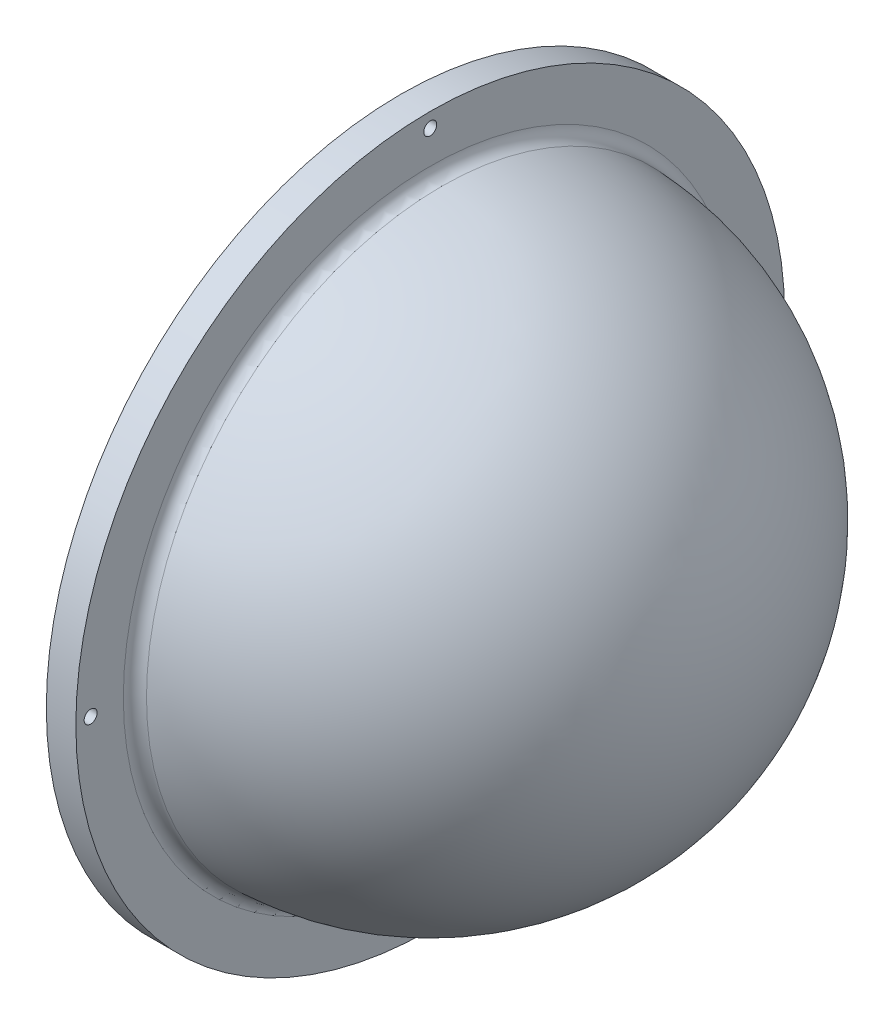
from build123d import *

# Parameters (mm, degrees)
FILLET1_R          = 2.54
SKETCH2_R          = 1.395150395
CUT_EXTRUDE1_DEPTH = 126.080494205


with BuildPart() as part:
    # Sketch1 → Revolve1 (revolve)
    with BuildSketch(Plane.XY, mode=Mode.PRIVATE) as revolve1_sk:
        with BuildLine():
            Line((0, 76.2), (6.35, 76.2))
            Line((6.35, 76.2), (6.35, 63.5))
            ThreePointArc((6.35, 63.5), (51.251280605, 44.901280605), (69.85, 0))
            Line((69.85, 0), (63.5, 0))
            ThreePointArc((63.5, 0), (46.761152545, 40.411152545), (6.35, 57.15))
            Line((6.35, 57.15), (0, 57.15))
            Line((0, 57.15), (0, 76.2))
        make_face()
    revolve(revolve1_sk.sketch.rotate(Axis((0, 0, 0), (1, 0, 0)), 90), axis=Axis((0, 0, 0), (1, 0, 0)))

    # Fillet1
    fillet1_edges = [part.edges().sort_by_distance(p)[0] for p in [
        (6.35, 0, -63.5),
    ]]
    fillet(fillet1_edges, radius=FILLET1_R)

    # Sketch2 → Cut-Extrude1 (cut, through all)
    with BuildSketch(Plane(origin=(6.35, 0, 0), x_dir=(0, 0, -1), z_dir=(1, 0, 0))):
        with Locations((0, 73.025)):
            Circle(SKETCH2_R)
        with Locations((73.025, 0)):
            Circle(SKETCH2_R)
        with Locations((0, -73.025)):
            Circle(SKETCH2_R)
        with Locations((-73.025, 0)):
            Circle(SKETCH2_R)
    extrude(amount=-CUT_EXTRUDE1_DEPTH, mode=Mode.SUBTRACT)


solid = part.part
